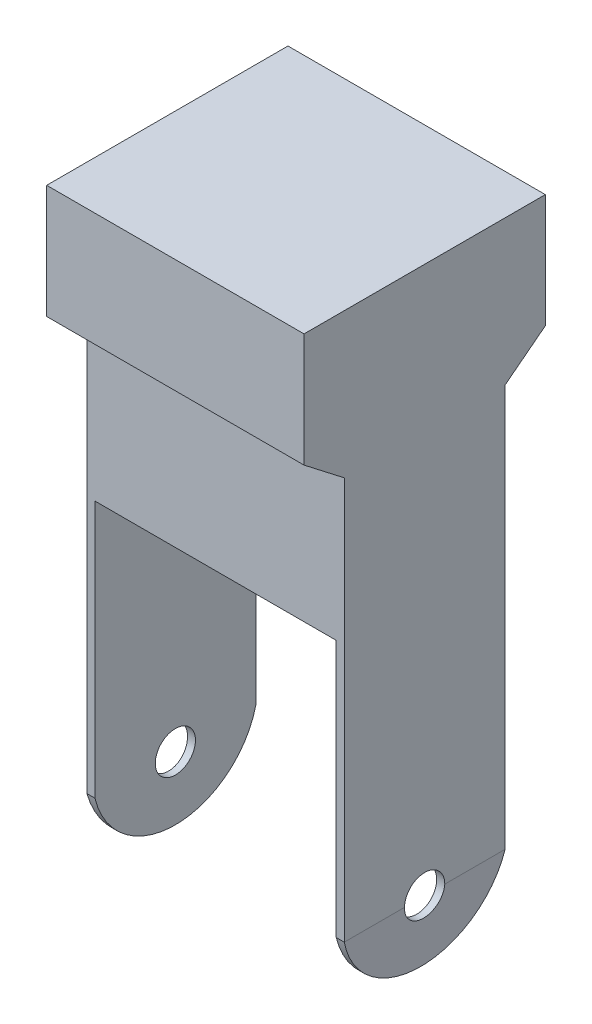
from build123d import *

# Parameters (mm, degrees)
BOSS_EXTRUDE1_DEPTH     = 15
CUT_EXTRUDE1_DEPTH      = 77.635500912
CUT_EXTRUDE1_DEPTH_BACK = 77.635500912
SKETCH3_R               = 2.5


with BuildPart() as part:
    # Sketch1 → Boss-Extrude1 (new, symmetric)
    with BuildSketch(Plane.XY):
        Polygon((-15, -8), (-15, 32), (15, 32), (15, -8), (15.5, -8), (16, 0), (16, 68), (-16, 68), (-16, 0), (-15.5, -8), align=None)
    extrude(amount=BOSS_EXTRUDE1_DEPTH, both=True)

    # Sketch3 → Cut-Extrude1 (cut, two sides: drawn at the far end of the back side and taken through both)
    with BuildSketch(Plane.ZY.offset(16).offset(-CUT_EXTRUDE1_DEPTH_BACK)):
        Circle(SKETCH3_R)
        with BuildLine():
            Line((-10, 0), (-10, 50))
            Line((-10, 50), (-16.325920345, 54.897216738))
            Line((-16.325920345, 54.897216738), (-25.192820329, 54.897216738))
            Line((-25.192820329, 54.897216738), (-25.192820329, -12.983802327))
            Line((-25.192820329, -12.983802327), (26.325920345, -12.983802327))
            Line((26.325920345, -12.983802327), (26.325920345, 54.897216738))
            Line((26.325920345, 54.897216738), (16.325920345, 54.897216738))
            Line((16.325920345, 54.897216738), (10, 50))
            Line((10, 50), (10, 0))
            ThreePointArc((10, 0), (0, -7.874716557), (-10, 0))
        make_face()
    extrude(amount=CUT_EXTRUDE1_DEPTH + CUT_EXTRUDE1_DEPTH_BACK, mode=Mode.SUBTRACT)


solid = part.part
